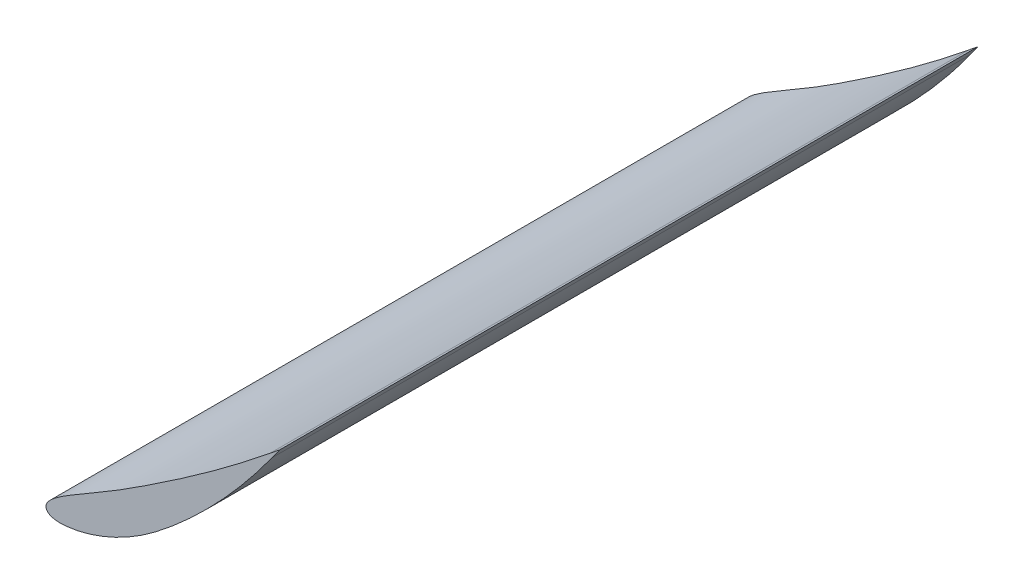
from build123d import *

# Parameters (mm, degrees)
BOSS_EXTRUDE3_DEPTH = 431.8


with BuildPart() as part:
    # Sketch3 → Boss-Extrude3 (new body)
    with BuildSketch(Plane.XY):
        with BuildLine():
            Line((137.784553458, 99.628193084), (143.8432216, 104.508217858))
            Line((143.8432216, 104.508217858), (139.047000748, 97.853646436))
            add(Edge.make_bspline(
                [(139.047000748, 97.853646436), (137.97909504, 96.371968459), (136.906284891, 94.894778956), (134.737771554, 91.961351334), (133.644147554, 90.503210371), (130.335340863, 86.154352913), (128.092436913, 83.289006519), (121.253020328, 74.79428273), (116.546943066, 69.265177319), (106.835952779, 58.480456726), (101.831514049, 53.224407475), (91.497100949, 43.010234548), (86.167656528, 38.051625869), (79.26810856, 32.070943514), (77.875291534, 30.884913983), (75.068706275, 28.540509819), (73.655737198, 27.383084145), (69.388886787, 23.95347773), (66.512958078, 21.714964406), (60.608772429, 17.470550419), (57.58645929, 15.45557328), (51.390880921, 11.656130231), (48.217478885, 9.871873228), (43.330929571, 7.388577348), (41.680964034, 6.593056862), (38.335450119, 5.071623116), (36.644031017, 4.347721505), (31.536795702, 2.304786963), (28.078707946, 1.107463199), (22.793121048, -0.384210327), (21.014729992, -0.830346646), (18.316792611, -1.405740853), (17.410905428, -1.581932189), (15.596450769, -1.896478541), (14.687757248, -2.034736304), (12.866935257, -2.266703128), (11.954832329, -2.360743448), (10.126236091, -2.491884101), (9.209820258, -2.529989278), (7.830603304, -2.527576597), (7.370099565, -2.516854076), (6.447204732, -2.47093146), (5.98350332, -2.435223468), (5.062778536, -2.330998216), (4.605199885, -2.263243879), (3.697911844, -2.08351822), (3.246630118, -1.97036893), (2.363231515, -1.682104645), (1.934676317, -1.508301405), (1.323973746, -1.175066751), (1.124547725, -1.051126045), (0.74767538, -0.779600052), (0.569719502, -0.631727538), (0.239639207, -0.306135393), (0.086329755, -0.126331907), (-0.177876178, 0.255402677), (-0.290287629, 0.457696526), (-0.473991291, 0.886144824), (-0.543920549, 1.110830632), (-0.631917634, 1.564169975), (-0.650144331, 1.796701649), (-0.637982247, 2.26469576), (-0.608401584, 2.49438244), (-0.512032745, 2.946931076), (-0.444705176, 3.171139852), (-0.197823237, 3.825123335), (0.023754745, 4.229782895), (0.530002705, 5.004418117), (0.814412641, 5.374505294), (1.412375453, 6.074005642), (1.727219109, 6.407052715), (2.702003215, 7.374337094), (3.393471566, 7.975375221), (4.817332608, 9.134357755), (5.552217492, 9.690778829), (7.781540307, 11.309347078), (9.306900059, 12.324969559), (12.390663437, 14.302675961), (13.950097479, 15.263090377), (17.085364098, 17.157349868), (18.661569979, 18.090590108), (23.400922625, 20.87291769), (26.574107712, 22.705740679), (32.906310871, 26.394340428), (36.065438941, 28.248890102), (42.346090536, 32.013077071), (45.467755448, 33.922521479), (50.111421101, 36.843603032), (51.652796569, 37.82684299), (54.720559623, 39.815290375), (56.247424747, 40.819797881), (60.826124413, 43.836098904), (63.878184785, 45.847561427), (73.008833939, 51.919370726), (79.067379939, 56.009093846), (91.090033772, 64.326956397), (97.05429657, 68.554868701), (108.873662809, 77.1706862), (114.729322122, 81.557776664), (123.433218001, 88.255070513), (126.321970426, 90.506745005), (130.634782352, 93.909224409), (132.068960749, 95.047698309), (134.931220805, 97.332324208), (136.358463719, 98.479532505), (137.784553458, 99.628193084)],
                knots=[0, 0, 0, 0, 0.015625, 0.015625, 0.03125, 0.03125, 0.0625, 0.0625, 0.125, 0.125, 0.1875, 0.1875, 0.25, 0.25, 0.265625, 0.265625, 0.28125, 0.28125, 0.3125, 0.3125, 0.34375, 0.34375, 0.375, 0.375, 0.390625, 0.390625, 0.40625, 0.40625, 0.4375, 0.4375, 0.453125, 0.453125, 0.4609375, 0.4609375, 0.46875, 0.46875, 0.4765625, 0.4765625, 0.484375, 0.484375, 0.48828125, 0.48828125, 0.4921875, 0.4921875, 0.49609375, 0.49609375, 0.5, 0.5, 0.50390625, 0.50390625, 0.505859375, 0.505859375, 0.5078125, 0.5078125, 0.509765625, 0.509765625, 0.51171875, 0.51171875, 0.513671875, 0.513671875, 0.515625, 0.515625, 0.517578125, 0.517578125, 0.51953125, 0.51953125, 0.5234375, 0.5234375, 0.52734375, 0.52734375, 0.53125, 0.53125, 0.5390625, 0.5390625, 0.546875, 0.546875, 0.5625, 0.5625, 0.578125, 0.578125, 0.59375, 0.59375, 0.625, 0.625, 0.65625, 0.65625, 0.6875, 0.6875, 0.703125, 0.703125, 0.71875, 0.71875, 0.75, 0.75, 0.8125, 0.8125, 0.875, 0.875, 0.9375, 0.9375, 0.96875, 0.96875, 0.984375, 0.984375, 1, 1, 1, 1], degree=3))
        make_face()
    extrude(amount=BOSS_EXTRUDE3_DEPTH)


solid = part.part
